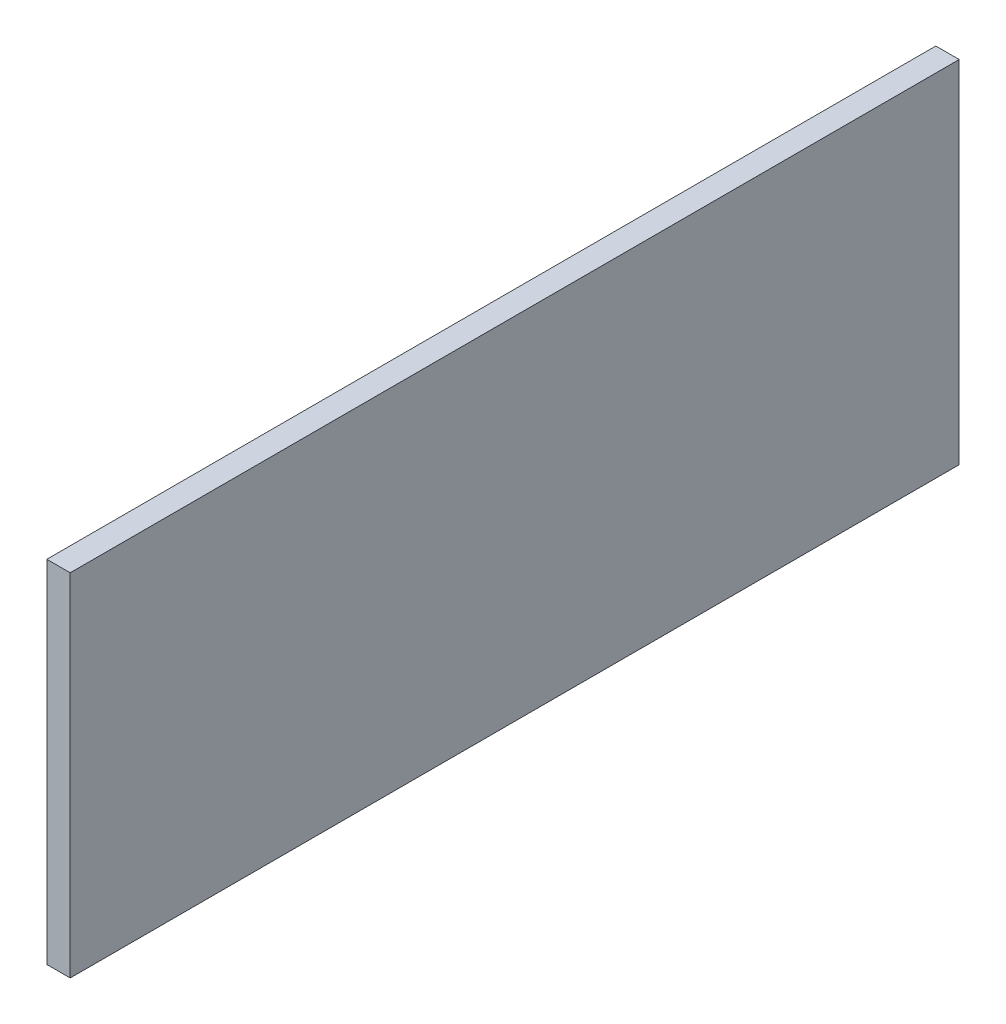
from build123d import *

# Parameters (mm, degrees)
SKETCH1_W           = 380
SKETCH1_H           = 150
BOSS_EXTRUDE1_DEPTH = 10


with BuildPart() as part:
    # Sketch1 → Boss-Extrude1 (new body)
    with BuildSketch(Plane(origin=(0, 0, 0), x_dir=(0, 0, -1), z_dir=(1, 0, 0))):
        Rectangle(SKETCH1_W, SKETCH1_H)
    extrude(amount=BOSS_EXTRUDE1_DEPTH)


solid = part.part
